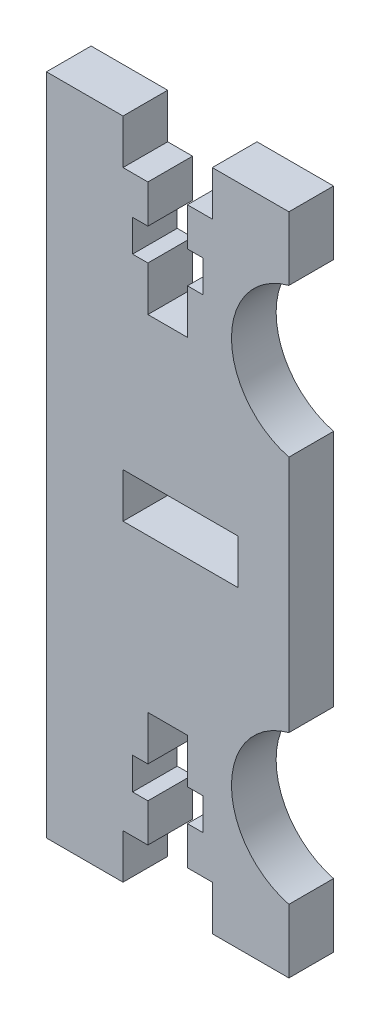
from build123d import *

# Parameters (mm, degrees)
BOSS_EXTRUDE1_DEPTH = 3.5
SKETCH2_W           = 9
SKETCH2_H           = 3.5
CUT_EXTRUDE1_DEPTH  = 28.901612857


with BuildPart() as part:
    # Sketch1 → Boss-Extrude1 (new body)
    with BuildSketch(Plane.XY):
        with BuildLine():
            Line((3.5, 26), (3.5, 22.5))
            Line((3.5, 22.5), (1.55, 22.5))
            Line((1.55, 22.5), (1.55, 19.5))
            Line((1.55, 19.5), (2.75, 19.5))
            Line((2.75, 19.5), (2.75, 17))
            Line((2.75, 17), (1.55, 17))
            Line((1.55, 17), (1.55, 13.5))
            Line((1.55, 13.5), (-1.55, 13.5))
            Line((-1.55, 13.5), (-1.55, 17))
            Line((-1.55, 17), (-2.75, 17))
            Line((-2.75, 17), (-2.75, 19.5))
            Line((-2.75, 19.5), (-1.55, 19.5))
            Line((-1.55, 19.5), (-1.55, 22.5))
            Line((-1.55, 22.5), (-3.5, 22.5))
            Line((-3.5, 22.5), (-3.5, 26))
            Line((-3.5, 26), (-9.5, 26))
            Line((-9.5, 26), (-9.5, -26))
            Line((-9.5, -26), (-3.5, -26))
            Line((-3.5, -26), (-3.5, -22.5))
            Line((-3.5, -22.5), (-1.55, -22.5))
            Line((-1.55, -22.5), (-1.55, -19.5))
            Line((-1.55, -19.5), (-2.75, -19.5))
            Line((-2.75, -19.5), (-2.75, -17))
            Line((-2.75, -17), (-1.55, -17))
            Line((-1.55, -17), (-1.55, -13.5))
            Line((-1.55, -13.5), (1.55, -13.5))
            Line((1.55, -13.5), (1.55, -17))
            Line((1.55, -17), (2.75, -17))
            Line((2.75, -17), (2.75, -19.5))
            Line((2.75, -19.5), (1.55, -19.5))
            Line((1.55, -19.5), (1.55, -22.5))
            Line((1.55, -22.5), (3.5, -22.5))
            Line((3.5, -22.5), (3.5, -26))
            Line((3.5, -26), (9.5, -26))
            Line((9.5, -26), (9.5, -21))
            ThreePointArc((9.5, -21), (5, -15.175053648), (9.5, -9.350107297))
            Line((9.5, -9.350107297), (9.5, 9.350107297))
            ThreePointArc((9.5, 9.350107297), (5, 15.175053648), (9.5, 21))
            Line((9.5, 21), (9.5, 26))
            Line((9.5, 26), (3.5, 26))
        make_face()
    extrude(amount=BOSS_EXTRUDE1_DEPTH)

    # Sketch2 → Cut-Extrude1 (cut, through all)
    with BuildSketch(Plane.XY.offset(3.5)):
        with Locations((1, 0.25)):
            Rectangle(SKETCH2_W, SKETCH2_H)
    extrude(amount=-CUT_EXTRUDE1_DEPTH, mode=Mode.SUBTRACT)


solid = part.part
